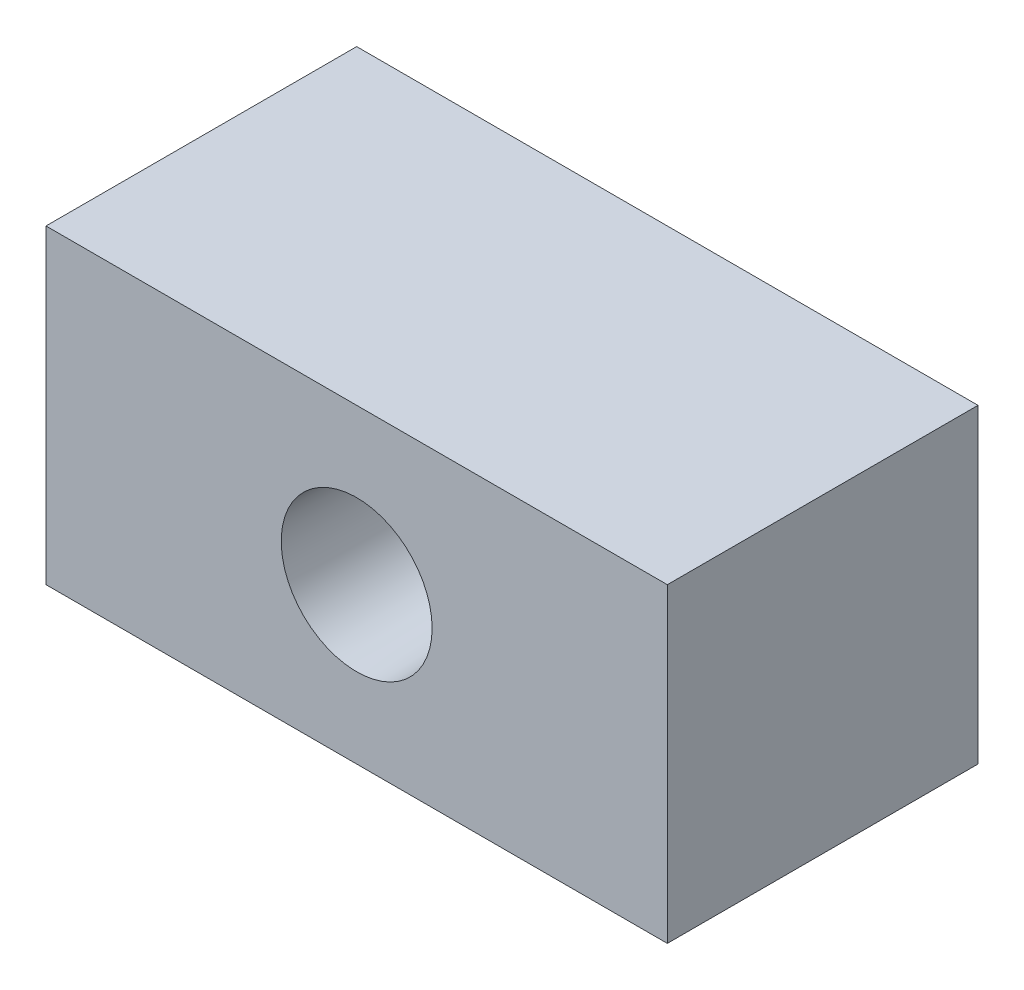
from build123d import *

# Parameters (mm, degrees)
SKETCH_1_W          = 14
SKETCH_1_H          = 7
EXTRUDE_1_DEPTH     = 7
SKETCH_2_R          = 1.7
CUT_EXTRUDE_1_DEPTH = 6
CUT_EXTRUDE_1_DRAFT = -2


with BuildPart() as part:
    # Эскиз1 → Бобышка-Вытянуть1 (new body)
    with BuildSketch(Plane(origin=(0, 66.754264805, 0), x_dir=(-1, 0, 0), z_dir=(0, 0, 1))):
        with Locations((0, 66.754264805)):
            Rectangle(SKETCH_1_W, SKETCH_1_H)
    extrude(amount=EXTRUDE_1_DEPTH)


with BuildPart() as cut_extrude_1_tool:
    # Эскиз2 → Вырез-Вытянуть1 (with draft: the straight prism first)
    with BuildSketch(Plane.XY.offset(7)):
        Circle(SKETCH_2_R)
    extrude(amount=-CUT_EXTRUDE_1_DEPTH)
    # Вырез-Вытянуть1: the draft: its side faces are tilted about the plane it starts from
    cut_extrude_1_sides = [cut_extrude_1_tool.faces().sort_by_distance(p)[0] for p in [
        (-1.7, 0, 4),
    ]]
    draft(cut_extrude_1_sides, Plane.XY.offset(7), CUT_EXTRUDE_1_DRAFT)


with BuildPart() as part_1:
    add(part.part)

    # Вырез-Вытянуть1: cut by cut_extrude_1_tool
    add(cut_extrude_1_tool.part, mode=Mode.SUBTRACT)


solid = part_1.part
